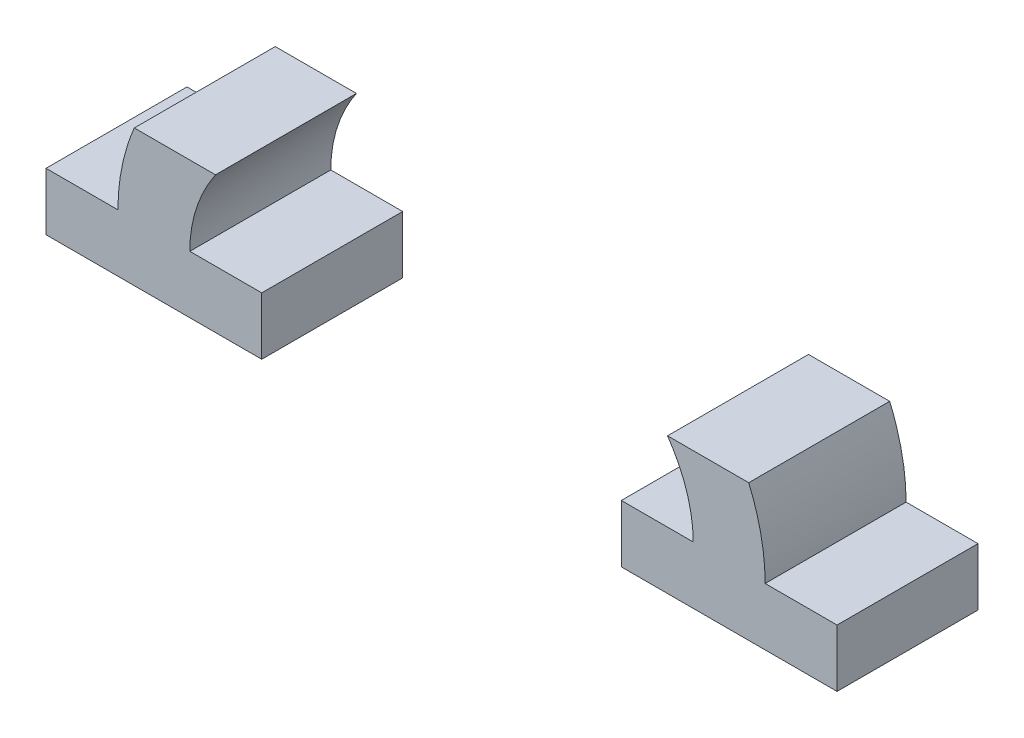
from build123d import *

# Parameters (mm, degrees)
BOSS_EXTRUDE1_DEPTH   = 9.8
BOSS_EXTRUDE1_2_DEPTH = 9.8


with BuildPart() as part:
    # Sketch1 → Boss-Extrude1 (new body)
    with BuildSketch(Plane.XY):
        with BuildLine():
            Line((21.359807465, 7.499999649), (15.714609084, 7.499999527))
            add(Edge.make_bspline(
                [(17.500570812, 2), (17.497736554, 2.250648162), (17.489372691, 2.500811888), (17.447201657, 2.998910307), (17.415689774, 3.247046086), (17.290247951, 3.988745802), (17.166508355, 4.473645999), (16.844231636, 5.422924534), (16.647556681, 5.881606182), (16.210844588, 6.728869849), (15.973532615, 7.120043174), (15.714609084, 7.499999527)],
                knots=[0, 0, 0, 0, 0.125, 0.125, 0.25, 0.25, 0.5, 0.5, 0.75, 0.75, 0.979788675, 0.979788675, 0.979788675, 0.979788675], degree=3))
            Line((17.500570812, 2), (12.5, 2))
            Line((12.5, 2), (12.5, -2))
            Line((12.5, -2), (27.5, -2))
            Line((27.5, -2), (27.5, 2))
            Line((27.5, 2), (22.500362017, 2))
            add(Edge.make_bspline(
                [(21.359807465, 7.499999649), (21.438687374, 7.311792042), (21.515814035, 7.122923168), (21.672586019, 6.707511572), (21.751832498, 6.480795242), (21.972643578, 5.794402537), (22.096671487, 5.330493497), (22.296957284, 4.390233007), (22.372744412, 3.916098335), (22.448993124, 3.199099588), (22.468095241, 2.959757941), (22.49360504, 2.480386933), (22.49860953, 2.240281554), (22.500362017, 2)],
                knots=[0.018816483, 0.018816483, 0.018816483, 0.018816483, 0.125, 0.125, 0.25, 0.25, 0.5, 0.5, 0.75, 0.75, 0.875, 0.875, 1, 1, 1, 1], degree=3))
        make_face()
    extrude(amount=BOSS_EXTRUDE1_DEPTH)


with BuildPart() as body_2:
    # Sketch1 → Boss-Extrude1 2 (new body)
    with BuildSketch(Plane.XY):
        with BuildLine():
            Line((-15.714596986, 7.50000025), (-21.359807236, 7.500000185))
            add(Edge.make_bspline(
                [(-22.500362017, 2), (-22.498609518, 2.240283209), (-22.49360505, 2.48039432), (-22.468092808, 2.95979609), (-22.448985784, 3.199183914), (-22.372729792, 3.916205194), (-22.296934114, 4.390363947), (-22.096638482, 5.330626264), (-21.972616627, 5.794495662), (-21.751806537, 6.480871265), (-21.672573061, 6.707547006), (-21.515809829, 7.122933381), (-21.438685531, 7.311796411), (-21.359807236, 7.500000185)],
                knots=[0, 0, 0, 0, 0.125, 0.125, 0.25, 0.25, 0.5, 0.5, 0.75, 0.75, 0.875, 0.875, 0.981183217, 0.981183217, 0.981183217, 0.981183217], degree=3))
            Line((-22.500362017, 2), (-27.5, 2))
            Line((-27.5, 2), (-27.5, -2))
            Line((-27.5, -2), (-12.5, -2))
            Line((-12.5, -2), (-12.5, 2))
            Line((-12.5, 2), (-17.500571029, 2))
            add(Edge.make_bspline(
                [(-15.714596986, 7.50000025), (-15.973284717, 7.120402883), (-16.211295478, 6.728341652), (-16.65074088, 5.875010273), (-16.846936492, 5.415932879), (-17.167809593, 4.468789326), (-17.291139784, 3.984489447), (-17.416033619, 3.244473774), (-17.447438121, 2.996665332), (-17.489425197, 2.499607562), (-17.497743216, 2.250030732), (-17.500571029, 2)],
                knots=[0.02023416, 0.02023416, 0.02023416, 0.02023416, 0.25, 0.25, 0.5, 0.5, 0.75, 0.75, 0.875, 0.875, 1, 1, 1, 1], degree=3))
        make_face()
    extrude(amount=BOSS_EXTRUDE1_2_DEPTH)


solid = Compound([part.part, body_2.part])
